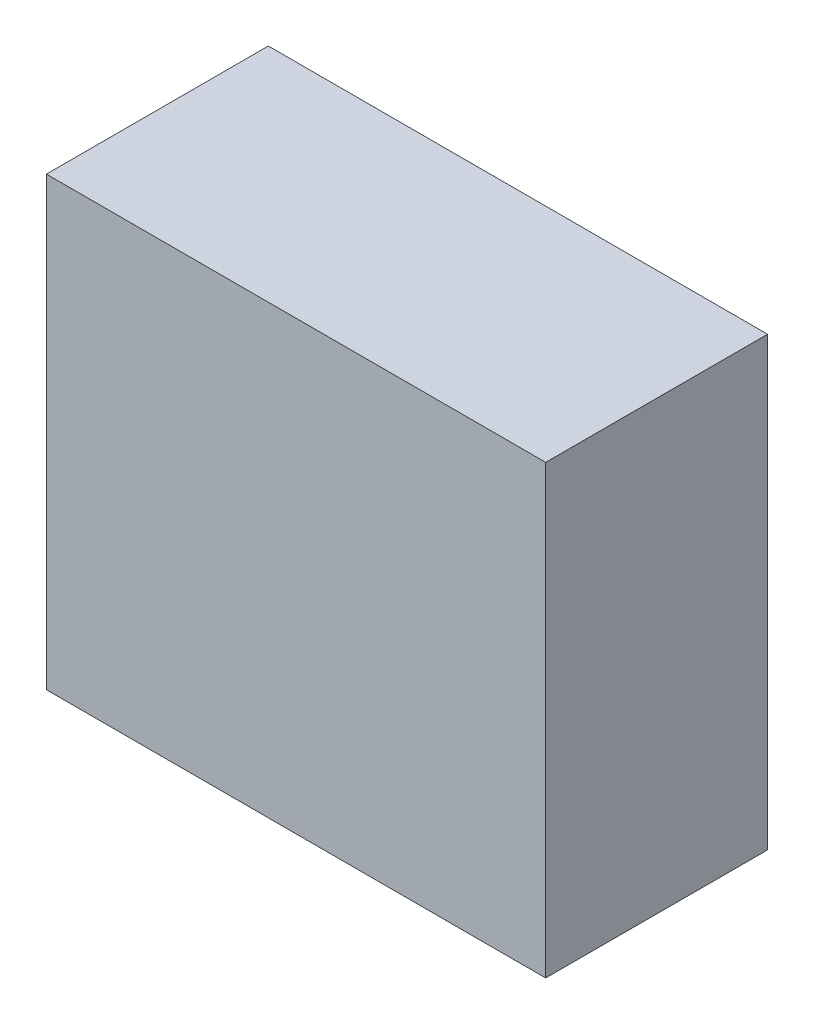
from build123d import *

# Parameters (mm, degrees)
SKETCH1_W           = 45.72
SKETCH1_H           = 20.32
BOSS_EXTRUDE1_DEPTH = 40.894


with BuildPart() as part:
    # Sketch1 → Boss-Extrude1 (new body)
    with BuildSketch(Plane(origin=(0, 0, 0), x_dir=(1, 0, 0), z_dir=(0, 1, 0))):
        with Locations((22.86, 10.16)):
            Rectangle(SKETCH1_W, SKETCH1_H)
    extrude(amount=BOSS_EXTRUDE1_DEPTH)


solid = part.part
